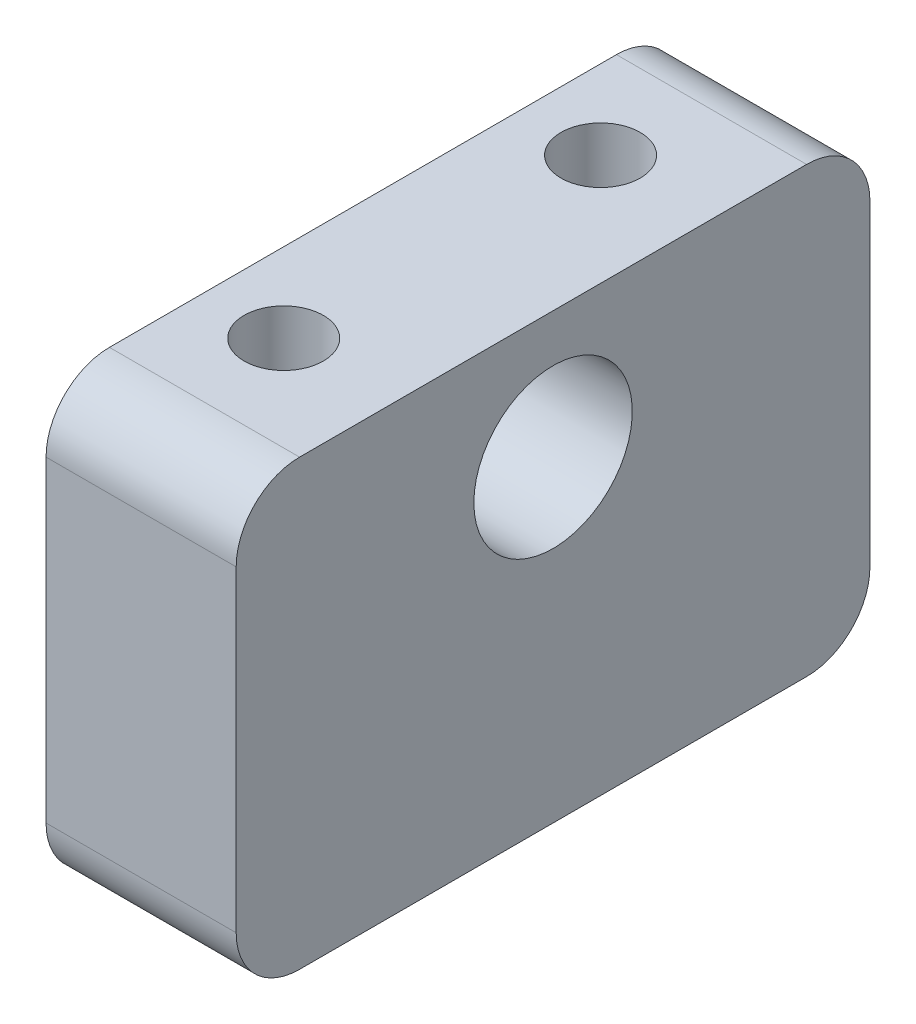
from build123d import *

# Parameters (mm, degrees)
SKETCH_1_W          = 6
SKETCH_1_H          = 20
EXTRUDE_1_DEPTH     = 14
SKETCH_2_R          = 1.25
CUT_EXTRUDE_1_DEPTH = 14
SKETCH_3_R          = 2.5
CUT_EXTRUDE_2_DEPTH = 14
FILLET_1_R          = 2


with BuildPart() as part:
    # 草图1 → 凸台-拉伸1 (new body)
    with BuildSketch(Plane(origin=(0, 0, 0), x_dir=(1, 0, 0), z_dir=(0, 1, 0))):
        Rectangle(SKETCH_1_W, SKETCH_1_H)
    extrude(amount=EXTRUDE_1_DEPTH)

    # 草图2 → 切除-拉伸1 (cut)
    with BuildSketch(Plane(origin=(0, 14, 0), x_dir=(1, 0, 0), z_dir=(0, 1, 0))):
        with Locations(Location((-0.5, -5, 0), (0, 0, 270))):
            Circle(SKETCH_2_R)
        with Locations(Location((-0.5, 5, 0), (0, 0, 270))):
            Circle(SKETCH_2_R)
    extrude(amount=-CUT_EXTRUDE_1_DEPTH, mode=Mode.SUBTRACT)

    # 草图3 → 切除-拉伸2 (cut)
    with BuildSketch(Plane.ZY.offset(3)):
        with Locations((0, 10)):
            Circle(SKETCH_3_R)
    extrude(amount=-CUT_EXTRUDE_2_DEPTH, mode=Mode.SUBTRACT)

    # 圆角1
    fillet_1_edges = [part.edges().sort_by_distance(p)[0] for p in [
        (0, 14, 10),
        (0, 0, 10),
        (0, 0, -10),
        (0, 14, -10),
    ]]
    fillet(fillet_1_edges, radius=FILLET_1_R)


solid = part.part
